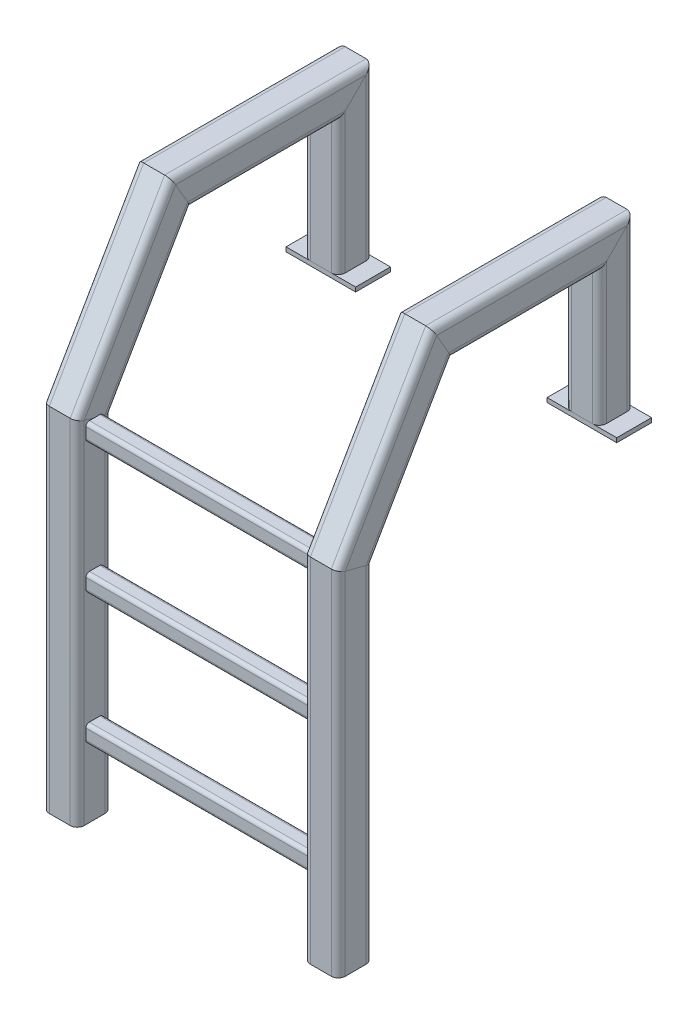
from build123d import *

# Parameters (mm, degrees)
SQUARE_TUBE_40_X_40_X_4_1_DEPTH   = 202.489352004
SQUARE_TUBE_40_X_40_X_4_1_2_DEPTH = 246.614202866
SQUARE_TUBE_40_X_40_X_4_1_3_DEPTH = 225.908679258
SQUARE_TUBE_40_X_40_X_4_1_4_DEPTH = 408.578747639
SQUARE_TUBE_40_X_40_X_4_1_5_DEPTH = 202.489352004
SQUARE_TUBE_40_X_40_X_4_1_6_DEPTH = 246.614202866
SQUARE_TUBE_40_X_40_X_4_1_7_DEPTH = 225.908679258
SQUARE_TUBE_40_X_40_X_4_1_8_DEPTH = 408.578747639
SKETCH14_W                        = 80
SKETCH14_H                        = 40
BOSS_EXTRUDE1_DEPTH               = 5
BOSS_EXTRUDE1_2_DEPTH             = 5
SQUARE_TUBE_20_X_20_X_2_1_DEPTH   = 300
SQUARE_TUBE_20_X_20_X_2_1_2_DEPTH = 300
SQUARE_TUBE_20_X_20_X_2_1_3_DEPTH = 300


with BuildPart() as part:
    # Sketch13 → Square tube 40 X 40 X 4(1) (new body)
    with BuildSketch(Plane(origin=(0, 0, -150), x_dir=(0, 0, 1), z_dir=(0, 1, 0))):
        with BuildLine():
            Line((-12, -20), (12, -20))
            ThreePointArc((12, -20), (17.656854249, -17.656854249), (20, -12))
            Line((20, -12), (20, 12))
            ThreePointArc((20, 12), (17.656854249, 17.656854249), (12, 20))
            Line((12, 20), (-12, 20))
            ThreePointArc((-12, 20), (-17.656854249, 17.656854249), (-20, 12))
            Line((-20, 12), (-20, -12))
            ThreePointArc((-20, -12), (-17.656854249, -17.656854249), (-12, -20))
        make_face()
        with BuildLine():
            Line((-12, -16), (12, -16))
            ThreePointArc((12, -16), (14.828427125, -14.828427125), (16, -12))
            Line((16, -12), (16, 12))
            ThreePointArc((16, 12), (14.828427125, 14.828427125), (12, 16))
            Line((12, 16), (-12, 16))
            ThreePointArc((-12, 16), (-14.828427125, 14.828427125), (-16, 12))
            Line((-16, 12), (-16, -12))
            ThreePointArc((-16, -12), (-14.828427125, -14.828427125), (-12, -16))
        make_face(mode=Mode.SUBTRACT)
    extrude(amount=SQUARE_TUBE_40_X_40_X_4_1_DEPTH)

    # Square tube 40 X 40 X 4(1) mitre 1
    split(bisect_by=Plane(origin=(0, 173.205080757, -150), x_dir=(1, 0, 0), z_dir=(0, -0.707106781, -0.707106781)), keep=Keep.TOP)


with BuildPart() as body_2:
    # Sketch13 on segment 2 (carried to segment 2) → Square tube 40 X 40 X 4_1 2 (new body)
    with BuildSketch(Plane(origin=(0, 173.205080757, -179.284271247), x_dir=(0, -1, 0), z_dir=(0, 0, 1))):
        with BuildLine():
            Line((-12, -20), (12, -20))
            ThreePointArc((12, -20), (17.656854249, -17.656854249), (20, -12))
            Line((20, -12), (20, 12))
            ThreePointArc((20, 12), (17.656854249, 17.656854249), (12, 20))
            Line((12, 20), (-12, 20))
            ThreePointArc((-12, 20), (-17.656854249, 17.656854249), (-20, 12))
            Line((-20, 12), (-20, -12))
            ThreePointArc((-20, -12), (-17.656854249, -17.656854249), (-12, -20))
        make_face()
        with BuildLine():
            Line((-12, -16), (12, -16))
            ThreePointArc((12, -16), (14.828427125, -14.828427125), (16, -12))
            Line((16, -12), (16, 12))
            ThreePointArc((16, 12), (14.828427125, 14.828427125), (12, 16))
            Line((12, 16), (-12, 16))
            ThreePointArc((-12, 16), (-14.828427125, 14.828427125), (-16, 12))
            Line((-16, 12), (-16, -12))
            ThreePointArc((-16, -12), (-14.828427125, -14.828427125), (-12, -16))
        make_face(mode=Mode.SUBTRACT)
    extrude(amount=SQUARE_TUBE_40_X_40_X_4_1_2_DEPTH)

    # Square tube 40 X 40 X 4_1 2 mitre 1
    split(bisect_by=Plane(origin=(0, 173.205080757, -150), x_dir=(-1, 0, 0), z_dir=(0, 0.707106781, 0.707106781)), keep=Keep.TOP)

    # Square tube 40 X 40 X 4_1 2 mitre 2
    split(bisect_by=Plane(origin=(0, 173.205080757, 50), x_dir=(-1, 0, 0), z_dir=(0, 0.5, -0.866025404)), keep=Keep.TOP)


with BuildPart() as body_3:
    # Sketch13 on segment 3 (carried to segment 3) → Square tube 40 X 40 X 4_1 3 (new body)
    with BuildSketch(Plane(origin=(0, 188.213241784, 41.335034191), x_dir=(0, -0.5, -0.866025404), z_dir=(0, -0.866025404, 0.5))):
        with BuildLine():
            Line((-12, -20), (12, -20))
            ThreePointArc((12, -20), (17.656854249, -17.656854249), (20, -12))
            Line((20, -12), (20, 12))
            ThreePointArc((20, 12), (17.656854249, 17.656854249), (12, 20))
            Line((12, 20), (-12, 20))
            ThreePointArc((-12, 20), (-17.656854249, 17.656854249), (-20, 12))
            Line((-20, 12), (-20, -12))
            ThreePointArc((-20, -12), (-17.656854249, -17.656854249), (-12, -20))
        make_face()
        with BuildLine():
            Line((-12, -16), (12, -16))
            ThreePointArc((12, -16), (14.828427125, -14.828427125), (16, -12))
            Line((16, -12), (16, 12))
            ThreePointArc((16, 12), (14.828427125, 14.828427125), (12, 16))
            Line((12, 16), (-12, 16))
            ThreePointArc((-12, 16), (-14.828427125, 14.828427125), (-16, 12))
            Line((-16, 12), (-16, -12))
            ThreePointArc((-16, -12), (-14.828427125, -14.828427125), (-12, -16))
        make_face(mode=Mode.SUBTRACT)
    extrude(amount=SQUARE_TUBE_40_X_40_X_4_1_3_DEPTH)

    # Square tube 40 X 40 X 4_1 3 mitre 1
    split(bisect_by=Plane(origin=(0, 173.205080757, 50), x_dir=(1, 0, 0), z_dir=(0, -0.5, 0.866025404)), keep=Keep.TOP)

    # Square tube 40 X 40 X 4_1 3 mitre 2
    split(bisect_by=Plane(origin=(0, 0, 150), x_dir=(-1, 0, 0), z_dir=(0, 0.965925826, -0.258819045)), keep=Keep.TOP)


with BuildPart() as body_4:
    # Sketch13 on segment 4 (carried to segment 4) → Square tube 40 X 40 X 4_1 4 (new body)
    with BuildSketch(Plane(origin=(0, 8.578747639, 150), x_dir=(0, 0, -1), z_dir=(0, -1, 0))):
        with BuildLine():
            Line((-12, -20), (12, -20))
            ThreePointArc((12, -20), (17.656854249, -17.656854249), (20, -12))
            Line((20, -12), (20, 12))
            ThreePointArc((20, 12), (17.656854249, 17.656854249), (12, 20))
            Line((12, 20), (-12, 20))
            ThreePointArc((-12, 20), (-17.656854249, 17.656854249), (-20, 12))
            Line((-20, 12), (-20, -12))
            ThreePointArc((-20, -12), (-17.656854249, -17.656854249), (-12, -20))
        make_face()
        with BuildLine():
            Line((-12, -16), (12, -16))
            ThreePointArc((12, -16), (14.828427125, -14.828427125), (16, -12))
            Line((16, -12), (16, 12))
            ThreePointArc((16, 12), (14.828427125, 14.828427125), (12, 16))
            Line((12, 16), (-12, 16))
            ThreePointArc((-12, 16), (-14.828427125, 14.828427125), (-16, 12))
            Line((-16, 12), (-16, -12))
            ThreePointArc((-16, -12), (-14.828427125, -14.828427125), (-12, -16))
        make_face(mode=Mode.SUBTRACT)
    extrude(amount=SQUARE_TUBE_40_X_40_X_4_1_4_DEPTH)

    # Square tube 40 X 40 X 4_1 4 mitre 1
    split(bisect_by=Plane(origin=(0, 0, 150), x_dir=(1, 0, 0), z_dir=(0, -0.965925826, 0.258819045)), keep=Keep.TOP)


with BuildPart() as body_5:
    # Sketch13 on segment 5 (carried to segment 5) → Square tube 40 X 40 X 4_1 5 (new body)
    with BuildSketch(Plane(origin=(-300, 0, -150), x_dir=(0, 0, 1), z_dir=(0, 1, 0))):
        with BuildLine():
            Line((-12, -20), (12, -20))
            ThreePointArc((12, -20), (17.656854249, -17.656854249), (20, -12))
            Line((20, -12), (20, 12))
            ThreePointArc((20, 12), (17.656854249, 17.656854249), (12, 20))
            Line((12, 20), (-12, 20))
            ThreePointArc((-12, 20), (-17.656854249, 17.656854249), (-20, 12))
            Line((-20, 12), (-20, -12))
            ThreePointArc((-20, -12), (-17.656854249, -17.656854249), (-12, -20))
        make_face()
        with BuildLine():
            Line((-12, -16), (12, -16))
            ThreePointArc((12, -16), (14.828427125, -14.828427125), (16, -12))
            Line((16, -12), (16, 12))
            ThreePointArc((16, 12), (14.828427125, 14.828427125), (12, 16))
            Line((12, 16), (-12, 16))
            ThreePointArc((-12, 16), (-14.828427125, 14.828427125), (-16, 12))
            Line((-16, 12), (-16, -12))
            ThreePointArc((-16, -12), (-14.828427125, -14.828427125), (-12, -16))
        make_face(mode=Mode.SUBTRACT)
    extrude(amount=SQUARE_TUBE_40_X_40_X_4_1_5_DEPTH)

    # Square tube 40 X 40 X 4_1 5 mitre 1
    split(bisect_by=Plane(origin=(-300, 173.205080757, -150), x_dir=(1, 0, 0), z_dir=(0, -0.707106781, -0.707106781)), keep=Keep.TOP)


with BuildPart() as body_6:
    # Sketch13 on segment 6 (carried to segment 6) → Square tube 40 X 40 X 4_1 6 (new body)
    with BuildSketch(Plane(origin=(-300, 173.205080757, 67.329931619), x_dir=(0, 1, 0), z_dir=(0, 0, -1))):
        with BuildLine():
            Line((-12, -20), (12, -20))
            ThreePointArc((12, -20), (17.656854249, -17.656854249), (20, -12))
            Line((20, -12), (20, 12))
            ThreePointArc((20, 12), (17.656854249, 17.656854249), (12, 20))
            Line((12, 20), (-12, 20))
            ThreePointArc((-12, 20), (-17.656854249, 17.656854249), (-20, 12))
            Line((-20, 12), (-20, -12))
            ThreePointArc((-20, -12), (-17.656854249, -17.656854249), (-12, -20))
        make_face()
        with BuildLine():
            Line((-12, -16), (12, -16))
            ThreePointArc((12, -16), (14.828427125, -14.828427125), (16, -12))
            Line((16, -12), (16, 12))
            ThreePointArc((16, 12), (14.828427125, 14.828427125), (12, 16))
            Line((12, 16), (-12, 16))
            ThreePointArc((-12, 16), (-14.828427125, 14.828427125), (-16, 12))
            Line((-16, 12), (-16, -12))
            ThreePointArc((-16, -12), (-14.828427125, -14.828427125), (-12, -16))
        make_face(mode=Mode.SUBTRACT)
    extrude(amount=SQUARE_TUBE_40_X_40_X_4_1_6_DEPTH)

    # Square tube 40 X 40 X 4_1 6 mitre 1
    split(bisect_by=Plane(origin=(-300, 173.205080757, 50), x_dir=(-1, 0, 0), z_dir=(0, 0.5, -0.866025404)), keep=Keep.TOP)

    # Square tube 40 X 40 X 4_1 6 mitre 2
    split(bisect_by=Plane(origin=(-300, 173.205080757, -150), x_dir=(-1, 0, 0), z_dir=(0, 0.707106781, 0.707106781)), keep=Keep.TOP)


with BuildPart() as body_7:
    # Sketch13 on segment 7 (carried to segment 7) → Square tube 40 X 40 X 4_1 7 (new body)
    with BuildSketch(Plane(origin=(-300, 188.213241784, 41.335034191), x_dir=(0, -0.5, -0.866025404), z_dir=(0, -0.866025404, 0.5))):
        with BuildLine():
            Line((-12, -20), (12, -20))
            ThreePointArc((12, -20), (17.656854249, -17.656854249), (20, -12))
            Line((20, -12), (20, 12))
            ThreePointArc((20, 12), (17.656854249, 17.656854249), (12, 20))
            Line((12, 20), (-12, 20))
            ThreePointArc((-12, 20), (-17.656854249, 17.656854249), (-20, 12))
            Line((-20, 12), (-20, -12))
            ThreePointArc((-20, -12), (-17.656854249, -17.656854249), (-12, -20))
        make_face()
        with BuildLine():
            Line((-12, -16), (12, -16))
            ThreePointArc((12, -16), (14.828427125, -14.828427125), (16, -12))
            Line((16, -12), (16, 12))
            ThreePointArc((16, 12), (14.828427125, 14.828427125), (12, 16))
            Line((12, 16), (-12, 16))
            ThreePointArc((-12, 16), (-14.828427125, 14.828427125), (-16, 12))
            Line((-16, 12), (-16, -12))
            ThreePointArc((-16, -12), (-14.828427125, -14.828427125), (-12, -16))
        make_face(mode=Mode.SUBTRACT)
    extrude(amount=SQUARE_TUBE_40_X_40_X_4_1_7_DEPTH)

    # Square tube 40 X 40 X 4_1 7 mitre 1
    split(bisect_by=Plane(origin=(-300, 173.205080757, 50), x_dir=(1, 0, 0), z_dir=(0, -0.5, 0.866025404)), keep=Keep.TOP)

    # Square tube 40 X 40 X 4_1 7 mitre 2
    split(bisect_by=Plane(origin=(-300, 0, 150), x_dir=(-1, 0, 0), z_dir=(0, 0.965925826, -0.258819045)), keep=Keep.TOP)


with BuildPart() as body_8:
    # Sketch13 on segment 8 (carried to segment 8) → Square tube 40 X 40 X 4_1 8 (new body)
    with BuildSketch(Plane(origin=(-300, 8.578747639, 150), x_dir=(0, 0, -1), z_dir=(0, -1, 0))):
        with BuildLine():
            Line((-12, -20), (12, -20))
            ThreePointArc((12, -20), (17.656854249, -17.656854249), (20, -12))
            Line((20, -12), (20, 12))
            ThreePointArc((20, 12), (17.656854249, 17.656854249), (12, 20))
            Line((12, 20), (-12, 20))
            ThreePointArc((-12, 20), (-17.656854249, 17.656854249), (-20, 12))
            Line((-20, 12), (-20, -12))
            ThreePointArc((-20, -12), (-17.656854249, -17.656854249), (-12, -20))
        make_face()
        with BuildLine():
            Line((-12, -16), (12, -16))
            ThreePointArc((12, -16), (14.828427125, -14.828427125), (16, -12))
            Line((16, -12), (16, 12))
            ThreePointArc((16, 12), (14.828427125, 14.828427125), (12, 16))
            Line((12, 16), (-12, 16))
            ThreePointArc((-12, 16), (-14.828427125, 14.828427125), (-16, 12))
            Line((-16, 12), (-16, -12))
            ThreePointArc((-16, -12), (-14.828427125, -14.828427125), (-12, -16))
        make_face(mode=Mode.SUBTRACT)
    extrude(amount=SQUARE_TUBE_40_X_40_X_4_1_8_DEPTH)

    # Square tube 40 X 40 X 4_1 8 mitre 1
    split(bisect_by=Plane(origin=(-300, 0, 150), x_dir=(1, 0, 0), z_dir=(0, -0.965925826, 0.258819045)), keep=Keep.TOP)


with BuildPart() as body_9:
    # Sketch14 → Boss-Extrude1 (new body)
    with BuildSketch(Plane.XZ):
        with Locations((-300, -150)):
            Rectangle(SKETCH14_W, SKETCH14_H)
    extrude(amount=BOSS_EXTRUDE1_DEPTH)


with BuildPart() as body_10:
    # Sketch14 → Boss-Extrude1 2 (new body)
    with BuildSketch(Plane.XZ):
        with Locations((0, -150)):
            Rectangle(SKETCH14_W, SKETCH14_H)
    extrude(amount=BOSS_EXTRUDE1_2_DEPTH)


with BuildPart() as body_11:
    # Sketch15 → Square tube 20 X 20 X 2(1) (new body)
    with BuildSketch(Plane(origin=(-300, -10, 150), x_dir=(0, 0, -1), z_dir=(1, 0, 0))):
        with BuildLine():
            Line((-6, -10), (6, -10))
            ThreePointArc((6, -10), (8.828427125, -8.828427125), (10, -6))
            Line((10, -6), (10, 6))
            ThreePointArc((10, 6), (8.828427125, 8.828427125), (6, 10))
            Line((6, 10), (-6, 10))
            ThreePointArc((-6, 10), (-8.828427125, 8.828427125), (-10, 6))
            Line((-10, 6), (-10, -6))
            ThreePointArc((-10, -6), (-8.828427125, -8.828427125), (-6, -10))
        make_face()
        with BuildLine():
            Line((-6, -8), (6, -8))
            ThreePointArc((6, -8), (7.414213562, -7.414213562), (8, -6))
            Line((8, -6), (8, 6))
            ThreePointArc((8, 6), (7.414213562, 7.414213562), (6, 8))
            Line((6, 8), (-6, 8))
            ThreePointArc((-6, 8), (-7.414213562, 7.414213562), (-8, 6))
            Line((-8, 6), (-8, -6))
            ThreePointArc((-8, -6), (-7.414213562, -7.414213562), (-6, -8))
        make_face(mode=Mode.SUBTRACT)
    extrude(amount=SQUARE_TUBE_20_X_20_X_2_1_DEPTH)


with BuildPart() as body_12:
    # Sketch15 on segment 2 (carried to segment 2) → Square tube 20 X 20 X 2_1 2 (new body)
    with BuildSketch(Plane(origin=(-300, -160, 150), x_dir=(0, 0, -1), z_dir=(1, 0, 0))):
        with BuildLine():
            Line((-6, -10), (6, -10))
            ThreePointArc((6, -10), (8.828427125, -8.828427125), (10, -6))
            Line((10, -6), (10, 6))
            ThreePointArc((10, 6), (8.828427125, 8.828427125), (6, 10))
            Line((6, 10), (-6, 10))
            ThreePointArc((-6, 10), (-8.828427125, 8.828427125), (-10, 6))
            Line((-10, 6), (-10, -6))
            ThreePointArc((-10, -6), (-8.828427125, -8.828427125), (-6, -10))
        make_face()
        with BuildLine():
            Line((-6, -8), (6, -8))
            ThreePointArc((6, -8), (7.414213562, -7.414213562), (8, -6))
            Line((8, -6), (8, 6))
            ThreePointArc((8, 6), (7.414213562, 7.414213562), (6, 8))
            Line((6, 8), (-6, 8))
            ThreePointArc((-6, 8), (-7.414213562, 7.414213562), (-8, 6))
            Line((-8, 6), (-8, -6))
            ThreePointArc((-8, -6), (-7.414213562, -7.414213562), (-6, -8))
        make_face(mode=Mode.SUBTRACT)
    extrude(amount=SQUARE_TUBE_20_X_20_X_2_1_2_DEPTH)


with BuildPart() as body_13:
    # Sketch15 on segment 3 (carried to segment 3) → Square tube 20 X 20 X 2_1 3 (new body)
    with BuildSketch(Plane(origin=(-300, -310, 150), x_dir=(0, 0, -1), z_dir=(1, 0, 0))):
        with BuildLine():
            Line((-6, -10), (6, -10))
            ThreePointArc((6, -10), (8.828427125, -8.828427125), (10, -6))
            Line((10, -6), (10, 6))
            ThreePointArc((10, 6), (8.828427125, 8.828427125), (6, 10))
            Line((6, 10), (-6, 10))
            ThreePointArc((-6, 10), (-8.828427125, 8.828427125), (-10, 6))
            Line((-10, 6), (-10, -6))
            ThreePointArc((-10, -6), (-8.828427125, -8.828427125), (-6, -10))
        make_face()
        with BuildLine():
            Line((-6, -8), (6, -8))
            ThreePointArc((6, -8), (7.414213562, -7.414213562), (8, -6))
            Line((8, -6), (8, 6))
            ThreePointArc((8, 6), (7.414213562, 7.414213562), (6, 8))
            Line((6, 8), (-6, 8))
            ThreePointArc((-6, 8), (-7.414213562, 7.414213562), (-8, 6))
            Line((-8, 6), (-8, -6))
            ThreePointArc((-8, -6), (-7.414213562, -7.414213562), (-6, -8))
        make_face(mode=Mode.SUBTRACT)
    extrude(amount=SQUARE_TUBE_20_X_20_X_2_1_3_DEPTH)


solid = Compound([part.part, body_2.part, body_3.part, body_4.part, body_5.part, body_6.part, body_7.part, body_8.part, body_9.part, body_10.part, body_11.part, body_12.part, body_13.part])
